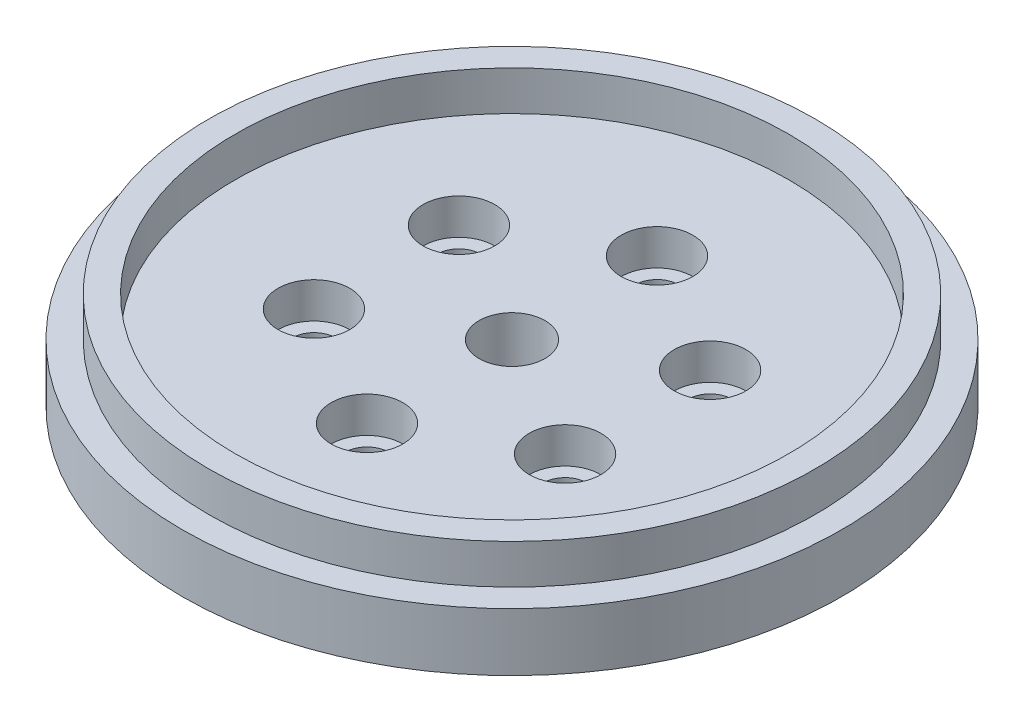
from build123d import *

# Parameters (mm, degrees)
SKETCH1_R           = 31.75
BOSS_EXTRUDE1_DEPTH = 5.588
SKETCH2_R           = 2.0955
CUT_EXTRUDE1_DEPTH  = 7.62
SKETCH5_R           = 3.4544
CUT_EXTRUDE2_DEPTH  = 3.4544
SKETCH6_R           = 3.175
CUT_EXTRUDE3_DEPTH  = 46.247660094
SKETCH9_R           = 29.21
SKETCH9_R_2         = 26.67
BOSS_EXTRUDE3_DEPTH = 3.81


with BuildPart() as part:
    # Sketch1 → Boss-Extrude1 (new body)
    with BuildSketch(Plane(origin=(0, 0, 0), x_dir=(1, 0, 0), z_dir=(0, 1, 0))):
        with Locations(Location((0, 0, 0), (0, 0, 270))):
            Circle(SKETCH1_R)
    extrude(amount=-BOSS_EXTRUDE1_DEPTH)

    # Sketch2 → Cut-Extrude1 (cut)
    with BuildSketch(Plane.XZ.offset(5.588)):
        with Locations(Location((0, 13.97, 0), (0, 0, 270))):
            Circle(SKETCH2_R)
        with Locations(Location((12.098374891, 6.985, 0), (0, 0, 270))):
            Circle(SKETCH2_R)
        with Locations(Location((12.098374891, -6.985, 0), (0, 0, 270))):
            Circle(SKETCH2_R)
        with Locations(Location((0, -13.97, 0), (0, 0, 270))):
            Circle(SKETCH2_R)
        with Locations(Location((-12.098374891, -6.985, 0), (0, 0, 270))):
            Circle(SKETCH2_R)
        with Locations(Location((-12.098374891, 6.985, 0), (0, 0, 270))):
            Circle(SKETCH2_R)
    extrude(amount=-CUT_EXTRUDE1_DEPTH, mode=Mode.SUBTRACT)

    # Sketch5 → Cut-Extrude2 (cut)
    with BuildSketch(Plane(origin=(0, 0, 0), x_dir=(1, 0, 0), z_dir=(0, 1, 0))):
        with Locations(Location((12.098374891, -6.985, 0), (0, 0, 270))):
            Circle(SKETCH5_R)
        with Locations(Location((0, -13.97, 0), (0, 0, 270))):
            Circle(SKETCH5_R)
        with Locations(Location((-12.098374891, -6.985, 0), (0, 0, 270))):
            Circle(SKETCH5_R)
        with Locations(Location((-12.098374891, 6.985, 0), (0, 0, 270))):
            Circle(SKETCH5_R)
        with Locations(Location((0, 13.97, 0), (0, 0, 270))):
            Circle(SKETCH5_R)
        with Locations(Location((12.098374891, 6.985, 0), (0, 0, 270))):
            Circle(SKETCH5_R)
    extrude(amount=-CUT_EXTRUDE2_DEPTH, mode=Mode.SUBTRACT)

    # Sketch6 → Cut-Extrude3 (cut, through all)
    with BuildSketch(Plane.XZ.offset(5.588)):
        with Locations(Location((0, 0, 0), (0, 0, 270))):
            Circle(SKETCH6_R)
    extrude(amount=-CUT_EXTRUDE3_DEPTH, mode=Mode.SUBTRACT)

    # Sketch9 → Boss-Extrude3 (add)
    with BuildSketch(Plane(origin=(0, 0, 0), x_dir=(1, 0, 0), z_dir=(0, 1, 0))):
        with Locations(Location((0, 0, 0), (0, 0, 90))):
            Circle(SKETCH9_R)
        with Locations(Location((0, 0, 0), (0, 0, 90))):
            Circle(SKETCH9_R_2, mode=Mode.SUBTRACT)
    extrude(amount=BOSS_EXTRUDE3_DEPTH)


solid = part.part
